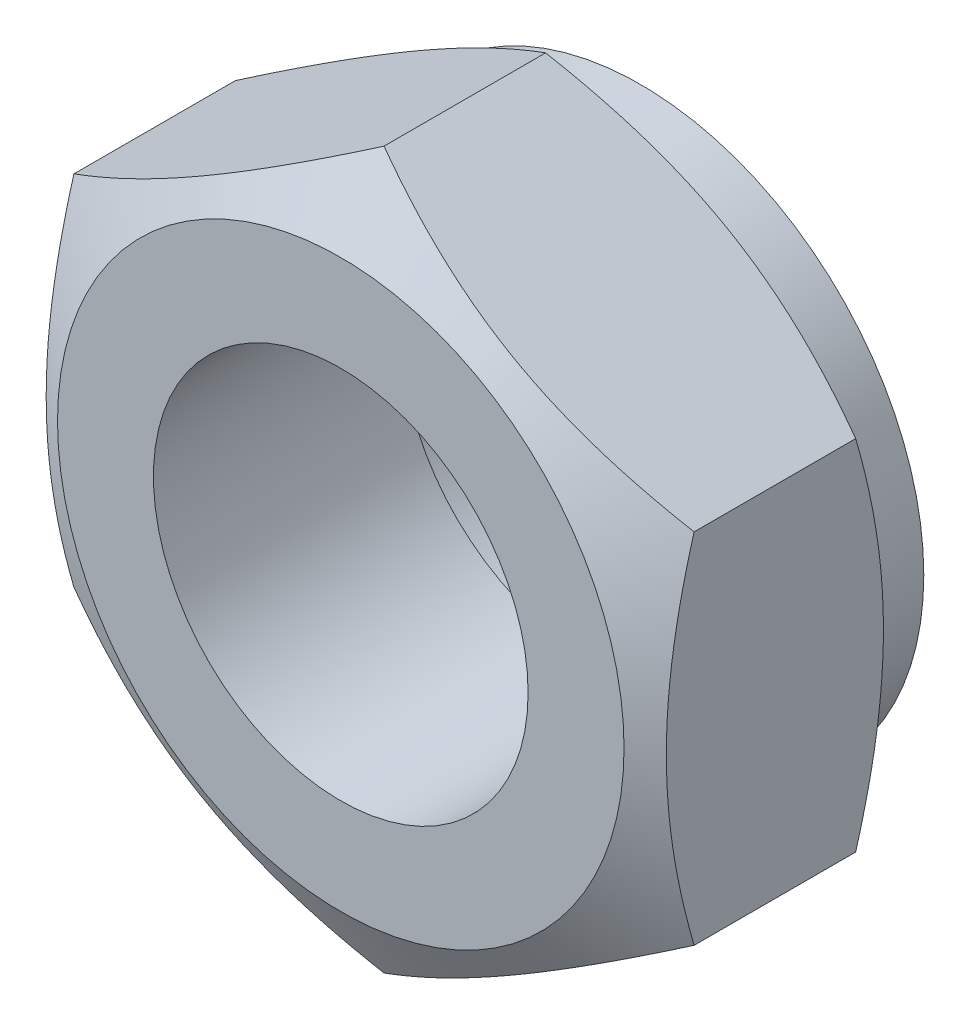
from build123d import *

# Parameters (mm, degrees)
EXTRUDE_1_DEPTH     = 4.8
SKETCH_3_R          = 7.25
CUT_EXTRUDE_1_DEPTH = 21.69202745
SKETCH_4_R          = 10.962716089
SKETCH_4_R_2        = 8.093789305
EXTRUDE_2_DEPTH     = 2


with BuildPart() as part:
    # 草图1 → 凸台-拉伸1 (new, symmetric)
    with BuildSketch(Plane.XY):
        Polygon((12, -6.92820323), (12, 6.92820323), (0, 13.856406461), (-12, 6.92820323), (-12, -6.92820323), (0, -13.856406461), align=None)
    extrude(amount=EXTRUDE_1_DEPTH, both=True)

    # 草图2 → 切除-旋转1 (revolve, cut)
    with BuildSketch(Plane(origin=(0, 0, 0), x_dir=(1, 0, 0), z_dir=(0, 1, 0))):
        Polygon((15.485203874, 8.108548082), (5.242876598, 8.108548082), (12, 4.2), (23.530399305, -2.469571859), align=None)
    cut_revolve_1 = revolve(axis=Axis((0, 0, -6.79329682), (0, 0, 1)), mode=Mode.SUBTRACT)

    # 镜向1: 切除-旋转1 across plane
    add(cut_revolve_1.mirror(Plane.XY), mode=Mode.SUBTRACT)

    # 草图3 → 切除-拉伸1 (cut, through all)
    with BuildSketch(Plane.XY.offset(4.8)):
        Circle(SKETCH_3_R)
    extrude(amount=-CUT_EXTRUDE_1_DEPTH, mode=Mode.SUBTRACT)

    # 草图4 → 凸台-拉伸2 (add)
    with BuildSketch(Plane(origin=(0, 0, -4.8), x_dir=(-1, 0, 0), z_dir=(0, 0, -1))):
        Circle(SKETCH_4_R)
        Circle(SKETCH_4_R_2, mode=Mode.SUBTRACT)
    extrude(amount=EXTRUDE_2_DEPTH)


solid = part.part
